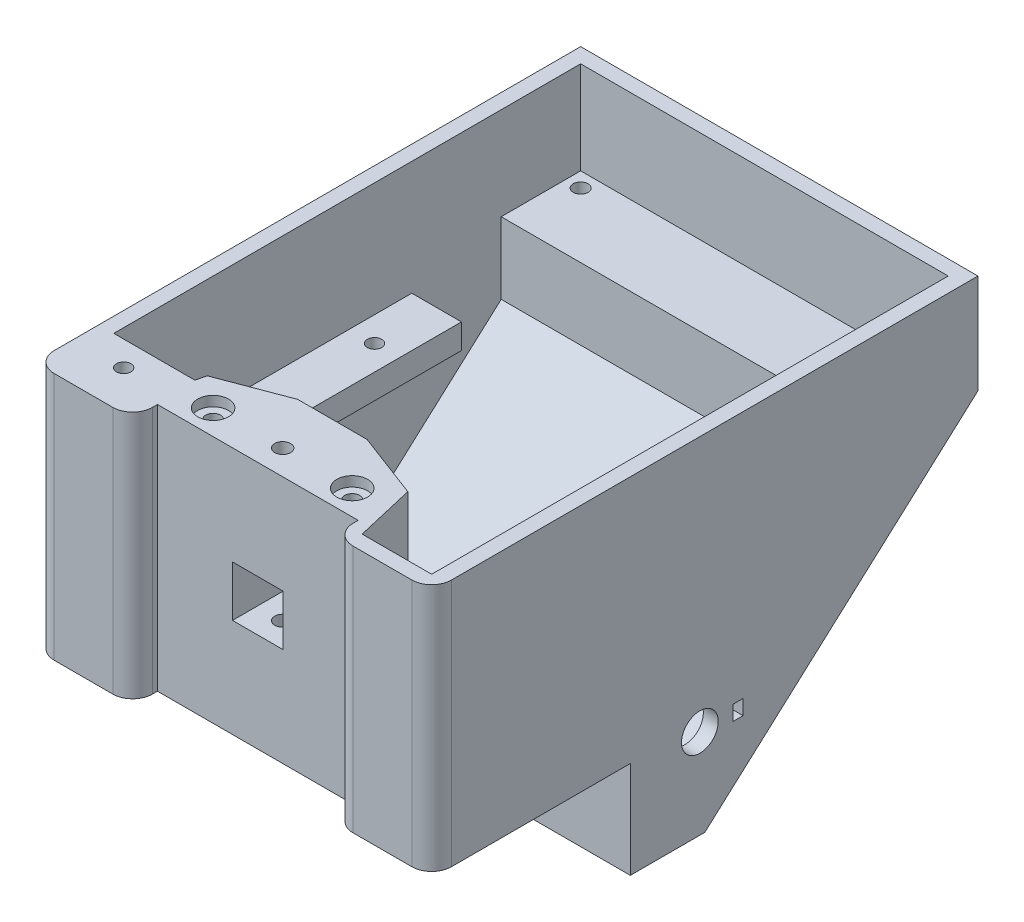
from build123d import *

# Parameters (mm, degrees)
BOSS_EXTRUDE1_DEPTH = 80
SHELL1_T            = -3
SKETCH3_W           = 46
SKETCH3_H           = 47
BOSS_EXTRUDE2_DEPTH = 17
SKETCH4_W           = 10.2
SKETCH4_H           = 10.2
CUT_EXTRUDE1_DEPTH  = 20
SKETCH6_W           = 15
SKETCH6_H           = 12.8
CUT_EXTRUDE2_DEPTH  = 3
SKETCH7_W           = 40.4
SKETCH7_H           = 50
CUT_EXTRUDE3_DEPTH  = 5
FILLET1_R           = 4
CUT_EXTRUDE7_DEPTH  = 47
SKETCH13_R          = 1.5
CUT_EXTRUDE8_DEPTH  = 25
SKETCH14_R          = 3.1
CUT_EXTRUDE9_DEPTH  = 2
SKETCH17_W          = 45
SKETCH17_H          = 5
BOSS_EXTRUDE5_DEPTH = 74
CUT_EXTRUDE10_REACH = 126.093
SKETCH18_W          = 54
SKETCH18_H          = 45
CUT_EXTRUDE11_REACH = 126.093
SKETCH19_R          = 1.45
BOSS_EXTRUDE6_DEPTH = 47
SKETCH22_R          = 1.45
CUT_EXTRUDE12_DEPTH = 135.415364765
CUT_EXTRUDE13_REACH = 126.857
SKETCH24_R          = 3.7
SKETCH24_W          = 2
SKETCH24_H          = 3
BOSS_EXTRUDE7_DEPTH = 74
SKETCH27_R          = 1.5
CUT_EXTRUDE14_DEPTH = 10
CUT_EXTRUDE15_START = -3
CUT_EXTRUDE15_DEPTH = 32
CUT_EXTRUDE16_DEPTH = 30
BOSS_EXTRUDE8_DEPTH = 20
SKETCH31_R          = 1.5
CUT_EXTRUDE17_DEPTH = 123.649786567
CUT_EXTRUDE18_DEPTH = 15
CUT_EXTRUDE19_REACH = 126.093
SKETCH33_W          = 10
SKETCH33_H          = 5
SKETCH34_R          = 1.6
CUT_EXTRUDE20_DEPTH = 135.415364765
CUT_EXTRUDE22_DEPTH = 14


with BuildPart() as part:
    # Sketch2 → Boss-Extrude1 (new body)
    with BuildSketch(Plane(origin=(0, 0, 0), x_dir=(0, 0, -1), z_dir=(1, 0, 0))):
        Polygon((-27.320490368, 20.998248687), (-27.320490368, -29.001751313), (12.679509632, -29.001751313), (12.679509632, -48.511383538), (27.679509632, -48.511383538), (82.679509632, 0.998248687), (82.679509632, 20.998248687), align=None)
    extrude(amount=BOSS_EXTRUDE1_DEPTH)

    # Shell1
    shell1_openings = [part.faces().sort_by_distance(p)[0] for p in [
        (40, 20.998248687, -27.679509632),
    ]]
    offset(amount=SHELL1_T, openings=shell1_openings, kind=Kind.INTERSECTION)

    # Sketch3 → Boss-Extrude2 (add)
    with BuildSketch(Plane(origin=(0, 0, 24.320490368), x_dir=(-1, 0, 0), z_dir=(0, 0, -1))):
        with Locations((-40, -2.501751313)):
            Rectangle(SKETCH3_W, SKETCH3_H)
    extrude(amount=BOSS_EXTRUDE2_DEPTH)

    # Sketch4 → Cut-Extrude1 (cut)
    with BuildSketch(Plane.XY.offset(27.320490368)):
        with Locations((40, -4.001751313)):
            Rectangle(SKETCH4_W, SKETCH4_H)
    extrude(amount=-CUT_EXTRUDE1_DEPTH, mode=Mode.SUBTRACT)

    # Sketch6 → Cut-Extrude2 (cut)
    with BuildSketch(Plane.XZ.offset(29.001751313)):
        with Locations((40, 0.920490368)):
            Rectangle(SKETCH6_W, SKETCH6_H)
    extrude(amount=-CUT_EXTRUDE2_DEPTH, mode=Mode.SUBTRACT)

    # Sketch7 → Cut-Extrude3 (cut)
    with BuildSketch(Plane.XY.offset(27.320490368)):
        with Locations((40, -4.001751313)):
            Rectangle(SKETCH7_W, SKETCH7_H)
    extrude(amount=-CUT_EXTRUDE3_DEPTH, mode=Mode.SUBTRACT)

    # Fillet1
    fillet1_edges = [part.edges().sort_by_distance(p)[0] for p in [
        (80, -4.001751313, 27.320490368),
        (19.8, -4.001751313, 27.320490368),
        (0, -4.001751313, 27.320490368),
        (60.2, -4.001751313, 27.320490368),
    ]]
    fillet(fillet1_edges, radius=FILLET1_R)

    # Sketch12 → Cut-Extrude7 (cut)
    with BuildSketch(Plane(origin=(0, 20.998248687, 0), x_dir=(1, 0, 0), z_dir=(0, 1, 0))):
        Polygon((33, -7.320490368), (19.8, -12.320490368), (17, -24.320490368), (17, -7.320490368), align=None)
        Polygon((47, -7.320490368), (63, -7.320490368), (63, -24.320490368), (60.2, -12.320490368), align=None)
    extrude(amount=-CUT_EXTRUDE7_DEPTH, mode=Mode.SUBTRACT)

    # Sketch13 → Cut-Extrude8 (cut)
    with BuildSketch(Plane(origin=(0, 20.998248687, 0), x_dir=(1, 0, 0), z_dir=(0, 1, 0))):
        with Locations(Location((26, -17.320490368, 0), (0, 0, 270))):
            Circle(SKETCH13_R)
        with Locations(Location((54, -17.320490368, 0), (0, 0, 270))):
            Circle(SKETCH13_R)
    extrude(amount=-CUT_EXTRUDE8_DEPTH, mode=Mode.SUBTRACT)

    # Sketch14 → Cut-Extrude9 (cut)
    with BuildSketch(Plane(origin=(0, 20.998248687, 0), x_dir=(1, 0, 0), z_dir=(0, 1, 0))):
        with Locations(Location((26, -17.320490368, 0), (0, 0, 270))):
            Circle(SKETCH14_R)
        with Locations(Location((54, -17.320490368, 0), (0, 0, 270))):
            Circle(SKETCH14_R)
    extrude(amount=-CUT_EXTRUDE9_DEPTH, mode=Mode.SUBTRACT)

    # Sketch17 → Boss-Extrude5 (add)
    with BuildSketch(Plane.ZY.offset(-77)):
        with Locations((-23.179509632, -4.501751313)):
            Rectangle(SKETCH17_W, SKETCH17_H)
    extrude(amount=BOSS_EXTRUDE5_DEPTH)

    # Sketch18 → Cut-Extrude10 (cut, up to next)
    with BuildSketch(Plane(origin=(0, -2.001751313, 0), x_dir=(1, 0, 0), z_dir=(0, 1, 0)), mode=Mode.PRIVATE) as cut_extrude10_sk1:
        with Locations((40, 23.179509632)):
            Rectangle(SKETCH18_W, SKETCH18_H)
    cut_extrude10_tool1 = extrude(cut_extrude10_sk1.sketch, amount=-CUT_EXTRUDE10_REACH, mode=Mode.PRIVATE) & part.part
    add(cut_extrude10_tool1.solids().sort_by_distance((40, -2.001751, -23.17951))[0], mode=Mode.SUBTRACT)

    # Sketch19 → Cut-Extrude11 (cut, up to next)
    with BuildSketch(Plane(origin=(0, -2.001751313, 0), x_dir=(1, 0, 0), z_dir=(0, 1, 0)), mode=Mode.PRIVATE) as cut_extrude11_sk1:
        with Locations(Location((72, 37.179509632, 0), (0, 0, 270))):
            Circle(SKETCH19_R)
    cut_extrude11_tool1 = extrude(cut_extrude11_sk1.sketch, amount=-CUT_EXTRUDE11_REACH, mode=Mode.PRIVATE) & part.part
    # Sketch19 → Cut-Extrude11 (cut, up to next)
    with BuildSketch(Plane(origin=(0, -2.001751313, 0), x_dir=(1, 0, 0), z_dir=(0, 1, 0)), mode=Mode.PRIVATE) as cut_extrude11_sk2:
        with Locations(Location((72, 6.179509632, 0), (0, 0, 270))):
            Circle(SKETCH19_R)
    cut_extrude11_tool2 = extrude(cut_extrude11_sk2.sketch, amount=-CUT_EXTRUDE11_REACH, mode=Mode.PRIVATE) & part.part
    # Sketch19 → Cut-Extrude11 (cut, up to next)
    with BuildSketch(Plane(origin=(0, -2.001751313, 0), x_dir=(1, 0, 0), z_dir=(0, 1, 0)), mode=Mode.PRIVATE) as cut_extrude11_sk3:
        with Locations(Location((8, 33.179509632, 0), (0, 0, 270))):
            Circle(SKETCH19_R)
    cut_extrude11_tool3 = extrude(cut_extrude11_sk3.sketch, amount=-CUT_EXTRUDE11_REACH, mode=Mode.PRIVATE) & part.part
    # Sketch19 → Cut-Extrude11 (cut, up to next)
    with BuildSketch(Plane(origin=(0, -2.001751313, 0), x_dir=(1, 0, 0), z_dir=(0, 1, 0)), mode=Mode.PRIVATE) as cut_extrude11_sk4:
        with Locations(Location((8, 6.179509632, 0), (0, 0, 270))):
            Circle(SKETCH19_R)
    cut_extrude11_tool4 = extrude(cut_extrude11_sk4.sketch, amount=-CUT_EXTRUDE11_REACH, mode=Mode.PRIVATE) & part.part
    add(cut_extrude11_tool1.solids().sort_by_distance((72, -2.001751, -37.17951))[0], mode=Mode.SUBTRACT)
    add(cut_extrude11_tool2.solids().sort_by_distance((72, -2.001751, -6.17951))[0], mode=Mode.SUBTRACT)
    add(cut_extrude11_tool3.solids().sort_by_distance((8, -2.001751, -33.17951))[0], mode=Mode.SUBTRACT)
    add(cut_extrude11_tool4.solids().sort_by_distance((8, -2.001751, -6.17951))[0], mode=Mode.SUBTRACT)

    # Sketch21 → Boss-Extrude6 (add)
    with BuildSketch(Plane(origin=(0, -26.001751313, 0), x_dir=(1, 0, 0), z_dir=(0, 1, 0))):
        Polygon((3, -24.320490368), (3, -14.320490368), (19.333333333, -14.320490368), (17, -24.320490368), align=None)
    extrude(amount=BOSS_EXTRUDE6_DEPTH)

    # Sketch22 → Cut-Extrude12 (cut, through all)
    with BuildSketch(Plane(origin=(0, 20.998248687, 0), x_dir=(1, 0, 0), z_dir=(0, 1, 0))):
        with Locations(Location((10, -19.320490368, 0), (0, 0, 270))):
            Circle(SKETCH22_R)
    extrude(amount=-CUT_EXTRUDE12_DEPTH, mode=Mode.SUBTRACT)

    # Sketch24 → Cut-Extrude13 (cut, up to next)
    with BuildSketch(Plane(origin=(80, 0, 0), x_dir=(0, 0, -1), z_dir=(1, 0, 0)), mode=Mode.PRIVATE) as cut_extrude13_sk1:
        with Locations((26.679509632, -30.511383538)):
            Circle(SKETCH24_R)
    cut_extrude13_tool1 = extrude(cut_extrude13_sk1.sketch, amount=-CUT_EXTRUDE13_REACH, mode=Mode.PRIVATE) & part.part
    # Sketch24 → Cut-Extrude13 (cut, up to next)
    with BuildSketch(Plane(origin=(80, 0, 0), x_dir=(0, 0, -1), z_dir=(1, 0, 0)), mode=Mode.PRIVATE) as cut_extrude13_sk2:
        with Locations((34.379509632, -30.511383538)):
            Rectangle(SKETCH24_W, SKETCH24_H)
    cut_extrude13_tool2 = extrude(cut_extrude13_sk2.sketch, amount=-CUT_EXTRUDE13_REACH, mode=Mode.PRIVATE) & part.part
    add(cut_extrude13_tool1.solids().sort_by_distance((80, -30.511384, -26.67951))[0], mode=Mode.SUBTRACT)
    add(cut_extrude13_tool2.solids().sort_by_distance((80, -30.511384, -34.37951))[0], mode=Mode.SUBTRACT)

    # Sketch26 → Boss-Extrude7 (add)
    with BuildSketch(Plane(origin=(3, 0, 0), x_dir=(0, 0, -1), z_dir=(1, 0, 0))):
        Polygon((79.679509632, 2.334161996), (63.679509632, 2.334161996), (63.679509632, -12.068640106), align=None)
    extrude(amount=BOSS_EXTRUDE7_DEPTH)

    # Sketch27 → Cut-Extrude14 (cut)
    with BuildSketch(Plane(origin=(0, 2.334161996, 0), x_dir=(1, 0, 0), z_dir=(0, 1, 0))):
        with Locations(Location((6, 76.679509632, 0), (0, 0, 270))):
            Circle(SKETCH27_R)
        with Locations(Location((74, 76.679509632, 0), (0, 0, 270))):
            Circle(SKETCH27_R)
    extrude(amount=-CUT_EXTRUDE14_DEPTH, mode=Mode.SUBTRACT)

    # Sketch28 → Cut-Extrude15 (cut)
    with BuildSketch(Plane(origin=(0, 2.334161996, 0), x_dir=(1, 0, 0), z_dir=(0, 1, 0)).offset(CUT_EXTRUDE15_START)):
        Polygon((74, 79.929509632), (71.185417438, 78.304509632), (71.185417438, 75.054509632), (74, 73.429509632), (76.814582562, 75.054509632), (76.814582562, 78.304509632), align=None)
        Polygon((6, 73.429509632), (8.814582562, 75.054509632), (8.814582562, 78.304509632), (6, 79.929509632), (3.185417438, 78.304509632), (3.185417438, 75.054509632), align=None)
    extrude(amount=-CUT_EXTRUDE15_DEPTH, mode=Mode.SUBTRACT)

    # Sketch29 → Cut-Extrude16 (cut)
    with BuildSketch(Plane.XZ.offset(29.001751313)):
        Polygon((7.185417438, 17.695490368), (10, 16.070490368), (12.814582562, 17.695490368), (12.814582562, 20.945490368), (10, 22.570490368), (7.185417438, 20.945490368), align=None)
    extrude(amount=-CUT_EXTRUDE16_DEPTH, mode=Mode.SUBTRACT)

    # Sketch30 → Boss-Extrude8 (add)
    with BuildSketch(Plane(origin=(0, -26.001751313, 0), x_dir=(1, 0, 0), z_dir=(0, 1, 0))):
        Polygon((77, -24.320490368), (63, -24.320490368), (60.2, -12.320490368), (77, -12.320490368), align=None)
    extrude(amount=BOSS_EXTRUDE8_DEPTH)

    # Sketch31 → Cut-Extrude17 (cut, through all)
    with BuildSketch(Plane(origin=(0, -6.001751313, 0), x_dir=(1, 0, 0), z_dir=(0, 1, 0))):
        with Locations(Location((72, -21.320490368, 0), (0, 0, 270))):
            Circle(SKETCH31_R)
    extrude(amount=-CUT_EXTRUDE17_DEPTH, mode=Mode.SUBTRACT)

    # Sketch32 → Cut-Extrude18 (cut)
    with BuildSketch(Plane.XZ.offset(29.001751313)):
        Polygon((72, 24.570490368), (69.185417438, 22.945490368), (69.185417438, 19.695490368), (72, 18.070490368), (74.814582562, 19.695490368), (74.814582562, 22.945490368), align=None)
    extrude(amount=-CUT_EXTRUDE18_DEPTH, mode=Mode.SUBTRACT)

    # Sketch33 → Cut-Extrude19 (cut, up to next)
    with BuildSketch(Plane(origin=(0, -2.001751313, 0), x_dir=(1, 0, 0), z_dir=(0, 1, 0)), mode=Mode.PRIVATE) as cut_extrude19_sk1:
        with Locations((72, 43.179509632)):
            Rectangle(SKETCH33_W, SKETCH33_H)
    cut_extrude19_tool1 = extrude(cut_extrude19_sk1.sketch, amount=-CUT_EXTRUDE19_REACH, mode=Mode.PRIVATE) & part.part
    add(cut_extrude19_tool1.solids().sort_by_distance((72, -2.001751, -43.17951))[0], mode=Mode.SUBTRACT)

    # Sketch34 → Cut-Extrude20 (cut, through all)
    with BuildSketch(Plane(origin=(0, 20.998248687, 0), x_dir=(1, 0, 0), z_dir=(0, 1, 0))):
        with Locations(Location((40, -17.320490368, 0), (0, 0, 270))):
            Circle(SKETCH34_R)
    extrude(amount=-CUT_EXTRUDE20_DEPTH, mode=Mode.SUBTRACT)

    # Sketch36 → Cut-Extrude22 (cut)
    with BuildSketch(Plane.XZ.offset(29.001751313)):
        Polygon((38.375, 20.13507293), (36.75, 17.320490368), (38.375, 14.505907805), (41.625, 14.505907805), (43.25, 17.320490368), (41.625, 20.13507293), align=None)
    extrude(amount=-CUT_EXTRUDE22_DEPTH, mode=Mode.SUBTRACT)


solid = part.part
